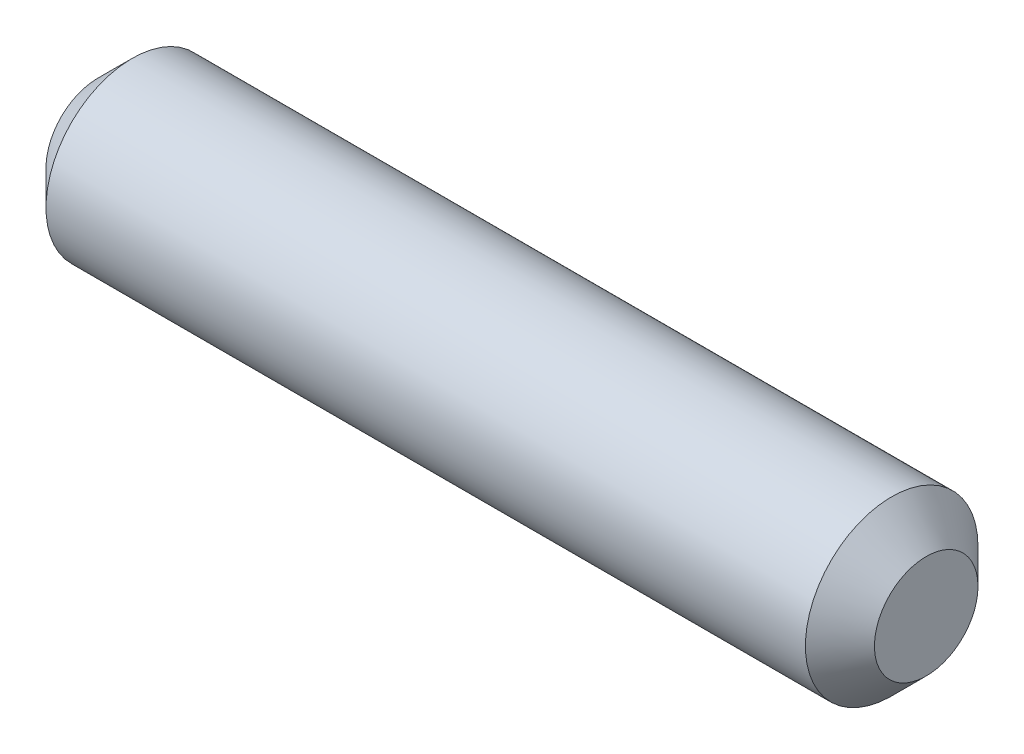
from build123d import *

# Parameters (mm, degrees)
SKETCH1_R           = 1.25
BOSS_EXTRUDE1_DEPTH = 12
CHAMFER1_SIZE       = 0.5


with BuildPart() as part:
    # Sketch1 → Boss-Extrude1 (new body)
    with BuildSketch(Plane(origin=(0, 0, 0), x_dir=(0, 0, -1), z_dir=(1, 0, 0))):
        Circle(SKETCH1_R)
    extrude(amount=BOSS_EXTRUDE1_DEPTH)

    # Chamfer1
    chamfer1_edges = [part.edges().sort_by_distance(p)[0] for p in [
        (0, 0, 1.25),
        (12, 0, 1.25),
    ]]
    chamfer(chamfer1_edges, length=CHAMFER1_SIZE)


solid = part.part
